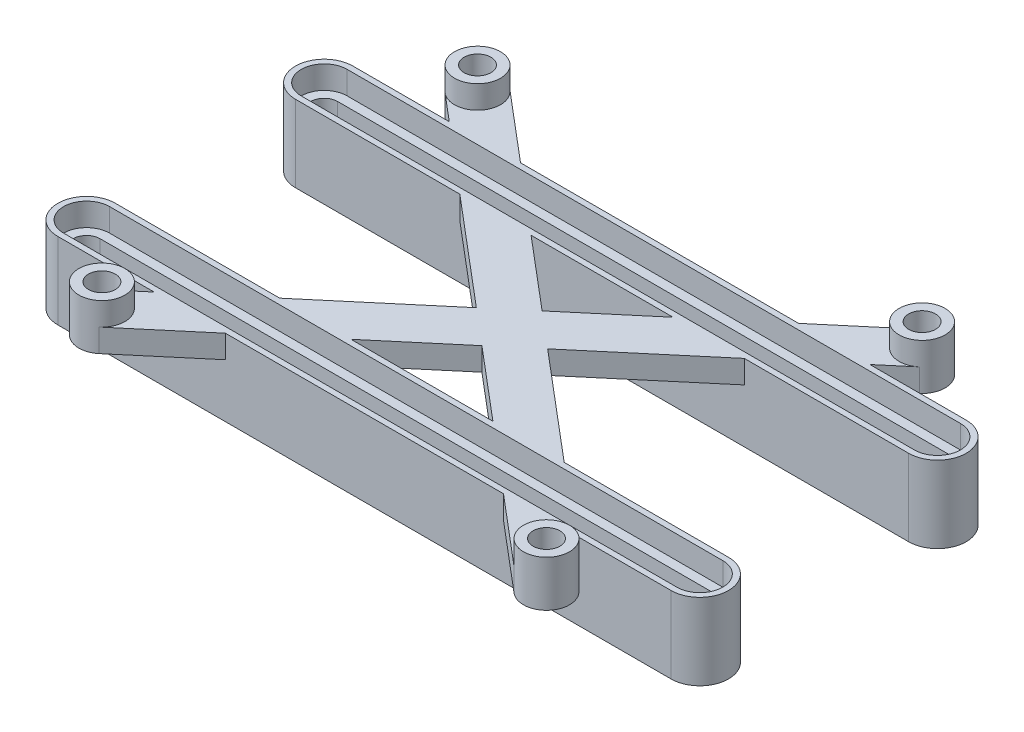
from build123d import *

# Parameters (mm, degrees)
BOSS_EXTRUDE1_DEPTH        = 10
BOSS_EXTRUDE1_2_DEPTH      = 10
CUT_EXTRUDE1_START         = -3
CUT_EXTRUDE1_DEPTH         = 3
BOSS_EXTRUDE2_DEPTH        = 3
BOSS_EXTRUDE2_DEPTH_BACK   = 3
SKETCH4_R                  = 3
SKETCH4_R_2                = 1.75
BOSS_EXTRUDE2_2_DEPTH      = 3
BOSS_EXTRUDE2_2_DEPTH_BACK = 3
BOSS_EXTRUDE2_3_DEPTH      = 3
BOSS_EXTRUDE2_3_DEPTH_BACK = 3
BOSS_EXTRUDE2_4_DEPTH      = 3
BOSS_EXTRUDE2_4_DEPTH_BACK = 3
BOSS_EXTRUDE3_DEPTH        = 3


with BuildPart() as part:
    # Sketch2 → Boss-Extrude1 (new body)
    with BuildSketch(Plane(origin=(0, 33.1, 0), x_dir=(1, 0, 0), z_dir=(0, 1, 0))):
        with BuildLine():
            ThreePointArc((53.031183993, 11.75), (56.781183993, 15.5), (53.031183993, 19.25))
            Line((53.031183993, 19.25), (-26.968816007, 19.25))
            ThreePointArc((-26.968816007, 19.25), (-30.718816007, 15.5), (-26.968816007, 11.75))
            Line((-26.968816007, 11.75), (53.031183993, 11.75))
        make_face()
        with BuildLine():
            ThreePointArc((-26.968816007, 13.75), (-28.718816007, 15.5), (-26.968816007, 17.25))
            Line((-26.968816007, 17.25), (53.031183993, 17.25))
            ThreePointArc((53.031183993, 17.25), (54.781183993, 15.5), (53.031183993, 13.75))
            Line((53.031183993, 13.75), (-26.968816007, 13.75))
        make_face(mode=Mode.SUBTRACT)
    extrude(amount=BOSS_EXTRUDE1_DEPTH)


with BuildPart() as body_2:
    # Sketch2 → Boss-Extrude1 2 (new body)
    with BuildSketch(Plane(origin=(0, 33.1, 0), x_dir=(1, 0, 0), z_dir=(0, 1, 0))):
        with BuildLine():
            ThreePointArc((-26.968816007, -11.75), (-30.718816007, -15.5), (-26.968816007, -19.25))
            Line((-26.968816007, -19.25), (53.031183993, -19.25))
            ThreePointArc((53.031183993, -19.25), (56.781183993, -15.5), (53.031183993, -11.75))
            Line((53.031183993, -11.75), (-26.968816007, -11.75))
        make_face()
        with BuildLine():
            ThreePointArc((-26.968816007, -17.25), (-28.718816007, -15.5), (-26.968816007, -13.75))
            Line((-26.968816007, -13.75), (53.031183993, -13.75))
            ThreePointArc((53.031183993, -13.75), (54.781183993, -15.5), (53.031183993, -17.25))
            Line((53.031183993, -17.25), (-26.968816007, -17.25))
        make_face(mode=Mode.SUBTRACT)
    extrude(amount=BOSS_EXTRUDE1_2_DEPTH)


with BuildPart() as cut_extrude1_tool:
    # Sketch3 → Cut-Extrude1 (new body)
    with BuildSketch(Plane(origin=(0, 43.1, 0), x_dir=(1, 0, 0), z_dir=(0, 1, 0)).offset(CUT_EXTRUDE1_START)):
        with BuildLine():
            ThreePointArc((-26.968816007, 13.75), (-28.718816007, 15.5), (-26.968816007, 17.25))
            Line((-26.968816007, 17.25), (-24.532117421, 17.25))
            ThreePointArc((-24.532117421, 17.25), (-25.599509613, 18.169269563), (-26.968816007, 18.5))
            ThreePointArc((-26.968816007, 18.5), (-29.968816007, 15.5), (-26.968816007, 12.5))
            ThreePointArc((-26.968816007, 12.5), (-25.599509613, 12.830730437), (-24.532117421, 13.75))
            Line((-24.532117421, 13.75), (-26.968816007, 13.75))
        make_face()
        with BuildLine():
            Line((-24.532117421, 17.25), (-26.968816007, 17.25))
            ThreePointArc((-26.968816007, 17.25), (-28.718816007, 15.5), (-26.968816007, 13.75))
            Line((-26.968816007, 13.75), (-24.532117421, 13.75))
            ThreePointArc((-24.532117421, 13.75), (-24.113111561, 14.580787228), (-23.968816007, 15.5))
            ThreePointArc((-23.968816007, 15.5), (-24.113111561, 16.419212772), (-24.532117421, 17.25))
        make_face()
        with BuildLine():
            ThreePointArc((-26.968816007, 18.5), (-25.599509613, 18.169269563), (-24.532117421, 17.25))
            Line((-24.532117421, 17.25), (50.594485407, 17.25))
            ThreePointArc((50.594485407, 17.25), (51.661877599, 18.169269563), (53.031183993, 18.5))
            Line((53.031183993, 18.5), (-26.968816007, 18.5))
        make_face()
        with BuildLine():
            Line((50.594485407, 13.75), (-24.532117421, 13.75))
            ThreePointArc((-24.532117421, 13.75), (-25.599509613, 12.830730437), (-26.968816007, 12.5))
            Line((-26.968816007, 12.5), (53.031183993, 12.5))
            ThreePointArc((53.031183993, 12.5), (51.661877599, 12.830730437), (50.594485407, 13.75))
        make_face()
        with BuildLine():
            ThreePointArc((53.031183993, 18.5), (51.661877599, 18.169269563), (50.594485407, 17.25))
            Line((50.594485407, 17.25), (53.031183993, 17.25))
            ThreePointArc((53.031183993, 17.25), (54.781183993, 15.5), (53.031183993, 13.75))
            Line((53.031183993, 13.75), (50.594485407, 13.75))
            ThreePointArc((50.594485407, 13.75), (51.661877599, 12.830730437), (53.031183993, 12.5))
            ThreePointArc((53.031183993, 12.5), (55.152504337, 13.378679656), (56.031183993, 15.5))
            ThreePointArc((56.031183993, 15.5), (55.152504337, 17.621320344), (53.031183993, 18.5))
        make_face()
        with BuildLine():
            Line((53.031183993, 17.25), (50.594485407, 17.25))
            ThreePointArc((50.594485407, 17.25), (50.031183993, 15.5), (50.594485407, 13.75))
            Line((50.594485407, 13.75), (53.031183993, 13.75))
            ThreePointArc((53.031183993, 13.75), (54.781183993, 15.5), (53.031183993, 17.25))
        make_face()
        with BuildLine():
            ThreePointArc((-26.968816007, -13.75), (-28.718816007, -15.5), (-26.968816007, -17.25))
            Line((-26.968816007, -17.25), (-24.532117421, -17.25))
            ThreePointArc((-24.532117421, -17.25), (-24.113111561, -16.419212772), (-23.968816007, -15.5))
            ThreePointArc((-23.968816007, -15.5), (-24.113111561, -14.580787228), (-24.532117421, -13.75))
            Line((-24.532117421, -13.75), (-26.968816007, -13.75))
        make_face()
        with BuildLine():
            Line((-24.532117421, -17.25), (-26.968816007, -17.25))
            ThreePointArc((-26.968816007, -17.25), (-28.718816007, -15.5), (-26.968816007, -13.75))
            Line((-26.968816007, -13.75), (-24.532117421, -13.75))
            ThreePointArc((-24.532117421, -13.75), (-25.599509613, -12.830730437), (-26.968816007, -12.5))
            ThreePointArc((-26.968816007, -12.5), (-29.968816007, -15.5), (-26.968816007, -18.5))
            ThreePointArc((-26.968816007, -18.5), (-25.599509613, -18.169269563), (-24.532117421, -17.25))
        make_face()
        with BuildLine():
            ThreePointArc((-26.968816007, -12.5), (-25.599509613, -12.830730437), (-24.532117421, -13.75))
            Line((-24.532117421, -13.75), (50.594485407, -13.75))
            ThreePointArc((50.594485407, -13.75), (51.661877599, -12.830730437), (53.031183993, -12.5))
            Line((53.031183993, -12.5), (-26.968816007, -12.5))
        make_face()
        with BuildLine():
            Line((50.594485407, -17.25), (-24.532117421, -17.25))
            ThreePointArc((-24.532117421, -17.25), (-25.599509613, -18.169269563), (-26.968816007, -18.5))
            Line((-26.968816007, -18.5), (53.031183993, -18.5))
            ThreePointArc((53.031183993, -18.5), (51.661877599, -18.169269563), (50.594485407, -17.25))
        make_face()
        with BuildLine():
            ThreePointArc((50.594485407, -13.75), (50.031183993, -15.5), (50.594485407, -17.25))
            Line((50.594485407, -17.25), (53.031183993, -17.25))
            ThreePointArc((53.031183993, -17.25), (54.781183993, -15.5), (53.031183993, -13.75))
            Line((53.031183993, -13.75), (50.594485407, -13.75))
        make_face()
        with BuildLine():
            Line((53.031183993, -17.25), (50.594485407, -17.25))
            ThreePointArc((50.594485407, -17.25), (51.661877599, -18.169269563), (53.031183993, -18.5))
            ThreePointArc((53.031183993, -18.5), (55.152504337, -17.621320344), (56.031183993, -15.5))
            ThreePointArc((56.031183993, -15.5), (55.152504337, -13.378679656), (53.031183993, -12.5))
            ThreePointArc((53.031183993, -12.5), (51.661877599, -12.830730437), (50.594485407, -13.75))
            Line((50.594485407, -13.75), (53.031183993, -13.75))
            ThreePointArc((53.031183993, -13.75), (54.781183993, -15.5), (53.031183993, -17.25))
        make_face()
    extrude(amount=CUT_EXTRUDE1_DEPTH)


with BuildPart() as part_1:
    add(part.part)

    # Cut-Extrude1: cut by cut_extrude1_tool
    add(cut_extrude1_tool.part, mode=Mode.SUBTRACT)



with BuildPart() as body_2_1:
    add(body_2.part)

    # Cut-Extrude1: cut by cut_extrude1_tool
    add(cut_extrude1_tool.part, mode=Mode.SUBTRACT)


with BuildPart() as body_3:
    # Sketch4 → Boss-Extrude2 (new, two sides: drawn at the far end of the back side and taken through both)
    with BuildSketch(Plane(origin=(0, 43.1, 0), x_dir=(1, 0, 0), z_dir=(0, 1, 0)).offset(-BOSS_EXTRUDE2_DEPTH_BACK)):
        with Locations(Location((-15.968816007, 24.5, 0), (0, 0, 270))):
            Circle(SKETCH4_R)
        with Locations(Location((-15.968816007, 24.5, 0), (0, 0, 270))):
            Circle(SKETCH4_R_2, mode=Mode.SUBTRACT)
    extrude(amount=BOSS_EXTRUDE2_DEPTH + BOSS_EXTRUDE2_DEPTH_BACK)


with BuildPart() as body_4:
    # Sketch4 → Boss-Extrude2 2 (new, two sides: drawn at the far end of the back side and taken through both)
    with BuildSketch(Plane(origin=(0, 43.1, 0), x_dir=(1, 0, 0), z_dir=(0, 1, 0)).offset(-BOSS_EXTRUDE2_2_DEPTH_BACK)):
        with Locations(Location((42.031183993, 24.5, 0), (0, 0, 90))):
            Circle(SKETCH4_R)
        with Locations(Location((42.031183993, 24.5, 0), (0, 0, 90))):
            Circle(SKETCH4_R_2, mode=Mode.SUBTRACT)
    extrude(amount=BOSS_EXTRUDE2_2_DEPTH + BOSS_EXTRUDE2_2_DEPTH_BACK)


with BuildPart() as body_5:
    # Sketch4 → Boss-Extrude2 3 (new, two sides: drawn at the far end of the back side and taken through both)
    with BuildSketch(Plane(origin=(0, 43.1, 0), x_dir=(1, 0, 0), z_dir=(0, 1, 0)).offset(-BOSS_EXTRUDE2_3_DEPTH_BACK)):
        with Locations(Location((42.031183993, -24.5, 0), (0, 0, 270))):
            Circle(SKETCH4_R)
        with Locations(Location((42.031183993, -24.5, 0), (0, 0, 270))):
            Circle(SKETCH4_R_2, mode=Mode.SUBTRACT)
    extrude(amount=BOSS_EXTRUDE2_3_DEPTH + BOSS_EXTRUDE2_3_DEPTH_BACK)


with BuildPart() as body_6:
    # Sketch4 → Boss-Extrude2 4 (new, two sides: drawn at the far end of the back side and taken through both)
    with BuildSketch(Plane(origin=(0, 43.1, 0), x_dir=(1, 0, 0), z_dir=(0, 1, 0)).offset(-BOSS_EXTRUDE2_4_DEPTH_BACK)):
        with Locations(Location((-15.968816007, -24.5, 0), (0, 0, 90))):
            Circle(SKETCH4_R)
        with Locations(Location((-15.968816007, -24.5, 0), (0, 0, 90))):
            Circle(SKETCH4_R_2, mode=Mode.SUBTRACT)
    extrude(amount=BOSS_EXTRUDE2_4_DEPTH + BOSS_EXTRUDE2_4_DEPTH_BACK)


with BuildPart() as part_2:
    add(part_1.part)

    add(body_2_1.part)  # Boss-Extrude3 merges body 2

    add(body_3.part)  # Boss-Extrude3 merges body 3

    add(body_4.part)  # Boss-Extrude3 merges body 4

    add(body_5.part)  # Boss-Extrude3 merges body 5

    add(body_6.part)  # Boss-Extrude3 merges body 6
    # Sketch5 → Boss-Extrude3 (add)
    with BuildSketch(Plane.XZ.offset(-40.1)):
        with BuildLine():
            Line((-14.403158686, -19.25), (-17.904870954, -22.208343123))
            ThreePointArc((-17.904870954, -22.208343123), (-14.705519692, -21.778955638), (-12.968816007, -24.5))
            ThreePointArc((-12.968816007, -24.5), (-13.247771645, -25.763296315), (-14.032761059, -26.791656877))
            Line((-14.032761059, -26.791656877), (-5.105901899, -19.25))
            Line((-5.105901899, -19.25), (-14.403158686, -19.25))
        make_face()
        Polygon((8.3825556, 0), (-5.525607665, -11.75), (3.771649121, -11.75), (13.031183993, -3.927289505), align=None)
        Polygon((13.031183993, 3.927289505), (8.3825556, 0), (13.031183993, -3.927289505), (17.679812386, 0), align=None)
        Polygon((17.679812386, 0), (13.031183993, -3.927289505), (22.290718865, -11.75), (31.587975652, -11.75), align=None)
        with BuildLine():
            Line((40.465526672, -19.25), (31.168269886, -19.25))
            Line((31.168269886, -19.25), (40.095129046, -26.791656877))
            ThreePointArc((40.095129046, -26.791656877), (39.739527117, -22.563945052), (43.967238941, -22.208343123))
            Line((43.967238941, -22.208343123), (40.465526672, -19.25))
        make_face()
        Polygon((-5.525607665, 11.75), (8.3825556, 0), (13.031183993, 3.927289505), (3.771649121, 11.75), align=None)
        with BuildLine():
            Line((-17.904870954, 22.208343123), (-14.403158686, 19.25))
            Line((-14.403158686, 19.25), (-5.105901899, 19.25))
            Line((-5.105901899, 19.25), (-14.032761059, 26.791656877))
            ThreePointArc((-14.032761059, 26.791656877), (-13.247771645, 25.763296315), (-12.968816007, 24.5))
            ThreePointArc((-12.968816007, 24.5), (-14.705519692, 21.778955638), (-17.904870954, 22.208343123))
        make_face()
        Polygon((22.290718865, 11.75), (13.031183993, 3.927289505), (17.679812386, 0), (31.587975652, 11.75), align=None)
        with BuildLine():
            Line((40.095129046, 26.791656877), (31.168269886, 19.25))
            Line((31.168269886, 19.25), (40.465526672, 19.25))
            Line((40.465526672, 19.25), (43.967238941, 22.208343123))
            ThreePointArc((43.967238941, 22.208343123), (39.739527117, 22.563945052), (40.095129046, 26.791656877))
        make_face()
    extrude(amount=-BOSS_EXTRUDE3_DEPTH)


solid = part_2.part
